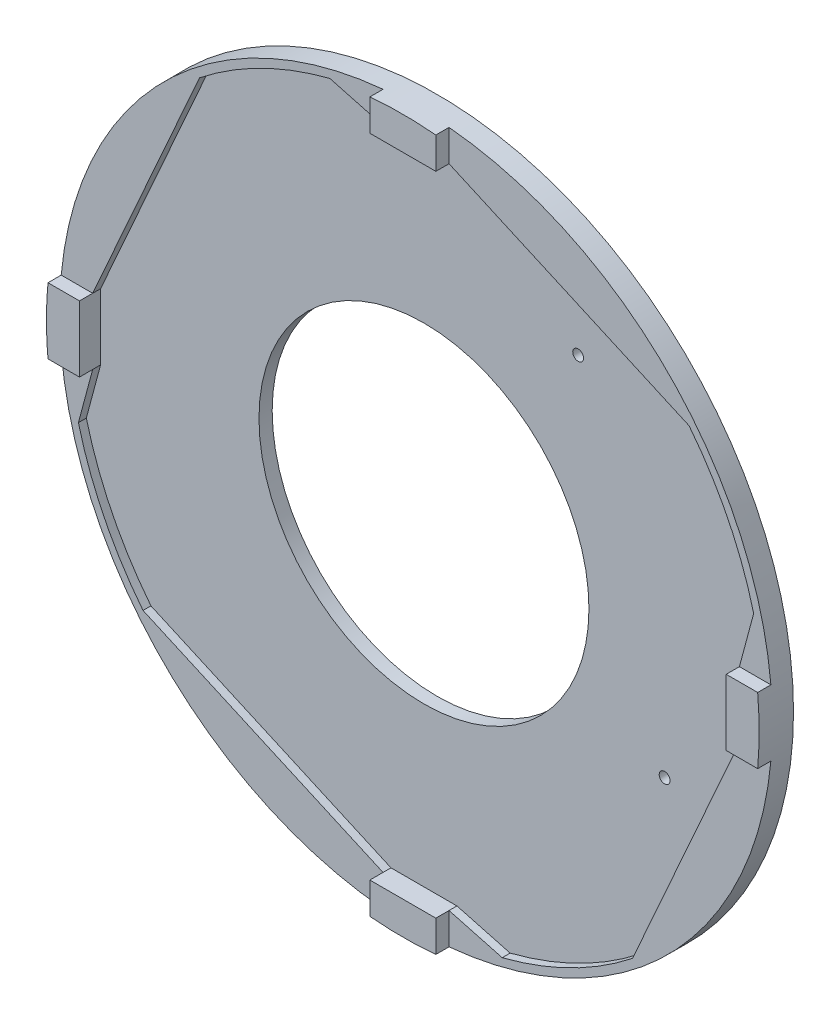
from build123d import *
from build123d.topology import SkipClean

# Parameters (mm, degrees)
SCHIZZO1_R                   = 135
ESTRUSIONE_ESTRUSIONE2_DEPTH = 3
SCHIZZO4_R                   = 132
TAGLIO_ESTRUSIONE1_DEPTH     = 191.942399692
ESTRUSIONE_ESTRUSIONE3_DEPTH = 8
RIPETIZIONECIRCOLARE2_COUNT  = 4
ESTRUSIONE_ESTRUSIONE5_START = -3
ESTRUSIONE_ESTRUSIONE5_DEPTH = 3
RIPETIZIONECIRCOLARE4_COUNT  = 4
ESTRUSIONE_ESTRUSIONE6_START = 5
SCHIZZO9_R                   = 135
ESTRUSIONE_ESTRUSIONE6_DEPTH = 5
SCHIZZO10_R                  = 62.5
TAGLIO_ESTRUSIONE2_DEPTH     = 10
SCHIZZO11_R                  = 2.05
TAGLIO_ESTRUSIONE3_DEPTH     = 10


with BuildPart() as part:
    # Schizzo1 → Estrusione-Estrusione2 (new body)
    with BuildSketch(Plane.XY):
        Circle(SCHIZZO1_R)
    extrude(amount=ESTRUSIONE_ESTRUSIONE2_DEPTH)

    # Schizzo4 → Taglio-Estrusione1 (cut, through all)
    with BuildSketch(Plane.XY.offset(3)):
        Circle(SCHIZZO4_R)
    extrude(amount=-TAGLIO_ESTRUSIONE1_DEPTH, mode=Mode.SUBTRACT)

    # Schizzo5 → Estrusione-Estrusione3 (add)
    with SkipClean():  # the faces are left unmerged after this step: merging them gives an invalid solid
        with BuildSketch(Plane(origin=(0, 0, 0), x_dir=(-1, 0, 0), z_dir=(0, 0, -1))):
            with BuildLine():
                Line((-12.5, 134.420050588), (-12.5, 122.5))
                Line((-12.5, 122.5), (12.5, 122.5))
                Line((12.5, 122.5), (12.5, 134.420050588))
                ThreePointArc((12.5, 134.420050588), (0, 135), (-12.5, 134.420050588))
            make_face()
        estrusione_estrusione3 = extrude(amount=-ESTRUSIONE_ESTRUSIONE3_DEPTH)

    # RipetizioneCircolare2: Estrusione-Estrusione3 ×4 about axis
    with SkipClean():  # the faces are left unmerged after this step: merging them gives an invalid solid
        ripetizionecircolare2_axis = Axis((0, 0, 0), (0, 0, 1))
        for i in range(1, RIPETIZIONECIRCOLARE2_COUNT):
            add(estrusione_estrusione3.rotate(ripetizionecircolare2_axis, i * 360 / RIPETIZIONECIRCOLARE2_COUNT))

    # Schizzo8 → Estrusione-Estrusione5 (add)
    with SkipClean():  # the faces are left unmerged after this step: merging them gives an invalid solid
        with BuildSketch(Plane(origin=(0, 0, 0), x_dir=(-1, 0, 0), z_dir=(0, 0, -1)).offset(ESTRUSIONE_ESTRUSIONE5_START)):
            with BuildLine():
                Line((-12.5, 122.5), (12.5, 122.5))
                Line((12.5, 122.5), (32.648342939, 127.898732219))
                ThreePointArc((32.648342939, 127.898732219), (-42.175054348, 125.081032898), (-103.427881869, 82.016298697))
                Line((-103.427881869, 82.016298697), (-12.5, 122.5))
            make_face()
        estrusione_estrusione5 = extrude(amount=ESTRUSIONE_ESTRUSIONE5_DEPTH)

    # RipetizioneCircolare4: Estrusione-Estrusione5 ×4 about axis
    with SkipClean():  # the faces are left unmerged after this step: merging them gives an invalid solid
        ripetizionecircolare4_axis = Axis((0, 0, 0), (0, 0, 1))
        for i in range(1, RIPETIZIONECIRCOLARE4_COUNT):
            add(estrusione_estrusione5.rotate(ripetizionecircolare4_axis, i * 360 / RIPETIZIONECIRCOLARE4_COUNT))

    # Schizzo9 → Estrusione-Estrusione6 (add)
    with SkipClean():  # the faces are left unmerged after this step: merging them gives an invalid solid
        with BuildSketch(Plane(origin=(0, 0, 0), x_dir=(-1, 0, 0), z_dir=(0, 0, -1)).offset(ESTRUSIONE_ESTRUSIONE6_START)):
            Circle(SCHIZZO9_R)
        extrude(amount=-ESTRUSIONE_ESTRUSIONE6_DEPTH)

    # Schizzo10 → Taglio-Estrusione2 (cut)
    with SkipClean():  # the faces are left unmerged after this step: merging them gives an invalid solid
        with BuildSketch(Plane(origin=(0, 0, -5), x_dir=(-1, 0, 0), z_dir=(0, 0, -1))):
            Circle(SCHIZZO10_R)
        extrude(amount=-TAGLIO_ESTRUSIONE2_DEPTH, mode=Mode.SUBTRACT)

    # Schizzo11 → Taglio-Estrusione3 (cut)
    with SkipClean():  # the faces are left unmerged after this step: merging them gives an invalid solid
        with BuildSketch(Plane(origin=(0, 0, -5), x_dir=(-1, 0, 0), z_dir=(0, 0, -1))):
            with Locations((-91.168439698, -41.089117817)):
                Circle(SCHIZZO11_R)
            with Locations((-58.409625893, 81.168439698)):
                Circle(SCHIZZO11_R)
        extrude(amount=-TAGLIO_ESTRUSIONE3_DEPTH, mode=Mode.SUBTRACT)


solid = part.part
